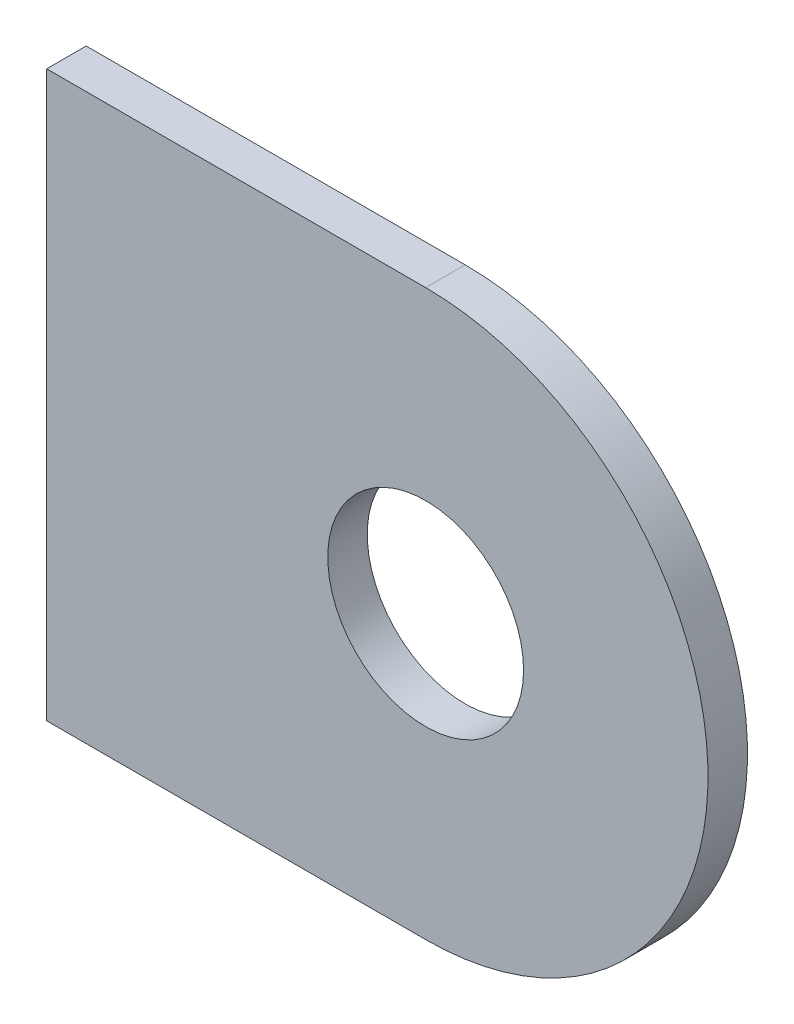
from build123d import *

# Parameters (mm, degrees)
SKETCH2_R           = 3.937
BOSS_EXTRUDE1_DEPTH = 1.5875


with BuildPart() as part:
    # Sketch2 → Boss-Extrude1 (new body)
    with BuildSketch(Plane.XY):
        with BuildLine():
            Line((0, 0), (15.24, 0))
            ThreePointArc((15.24, 0), (26.5938, 11.3538), (15.24, 22.7076))
            Line((15.24, 22.7076), (0, 22.7076))
            Line((0, 22.7076), (0, 0))
        make_face()
        with Locations((15.24, 11.3538)):
            Circle(SKETCH2_R, mode=Mode.SUBTRACT)
    extrude(amount=BOSS_EXTRUDE1_DEPTH)


solid = part.part
